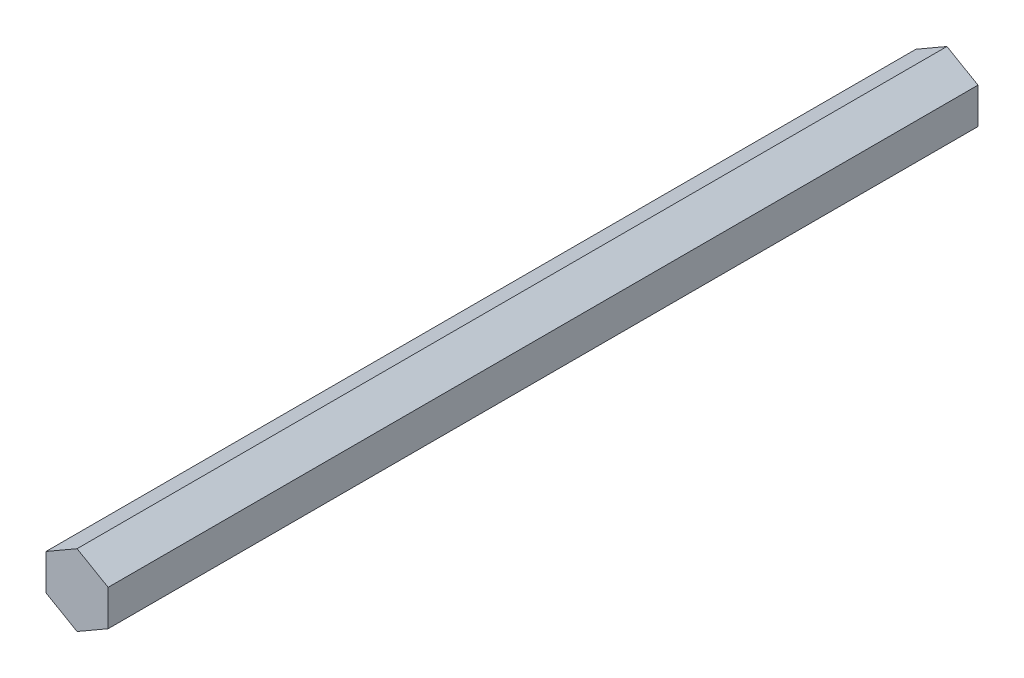
from build123d import *

# Parameters (mm, degrees)
BOSS_EXTRUDE1_DEPTH = 177.8


with BuildPart() as part:
    # Sketch1 → Boss-Extrude1 (new body)
    with BuildSketch(Plane.XY):
        Polygon((0, 7.332348419), (-6.35, 3.666174209), (-6.35, -3.666174209), (0, -7.332348419), (6.35, -3.666174209), (6.35, 3.666174209), align=None)
    extrude(amount=BOSS_EXTRUDE1_DEPTH)


solid = part.part
